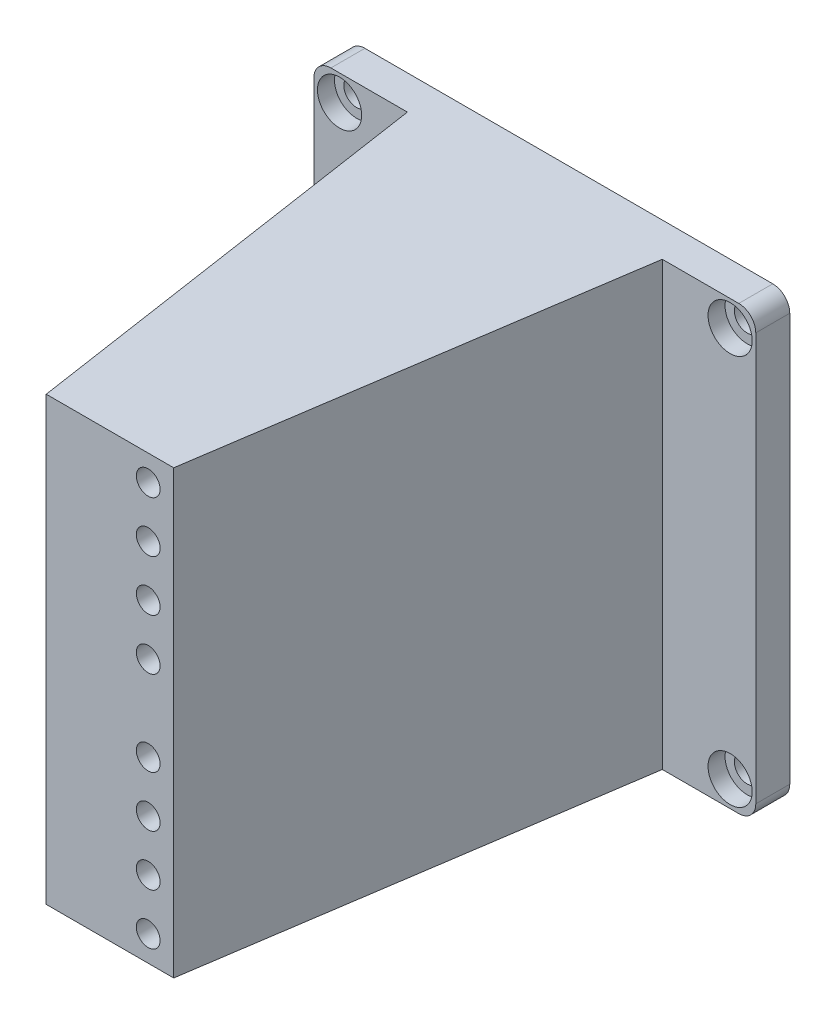
from build123d import *

# Parameters (mm, degrees)
SKETCH1_W           = 52
SKETCH1_H           = 52
BOSS_EXTRUDE1_DEPTH = 4
BOSS_EXTRUDE2_DEPTH = 52
SKETCH5_R           = 1.4
CUT_EXTRUDE4_DEPTH  = 6
SKETCH6_R           = 1.5
CUT_EXTRUDE5_DEPTH  = 6
SKETCH7_R           = 2.6
CUT_EXTRUDE6_DEPTH  = 2
FILLET1_R           = 2


with BuildPart() as part:
    # Sketch1 → Boss-Extrude1 (new body)
    with BuildSketch(Plane.XY):
        with Locations((26, 26)):
            Rectangle(SKETCH1_W, SKETCH1_H)
    extrude(amount=-BOSS_EXTRUDE1_DEPTH)

    # Sketch4 → Boss-Extrude2 (add)
    with BuildSketch(Plane(origin=(0, 52, 0), x_dir=(1, 0, 0), z_dir=(0, 1, 0))):
        Polygon((11, 0), (41, 0), (33.5, -50), (18.5, -50), align=None)
    extrude(amount=-BOSS_EXTRUDE2_DEPTH)

    # Sketch5 → Cut-Extrude4 (cut)
    with BuildSketch(Plane.XY.offset(50)):
        with Locations((30.5, 9)):
            Circle(SKETCH5_R)
        with Locations(Location((30.5, 3, 0), (0, 0, 180))):
            Circle(SKETCH5_R)
        with Locations(Location((30.5, 15, 0), (0, 0, 180))):
            Circle(SKETCH5_R)
        with Locations(Location((30.5, 21, 0), (0, 0, 180))):
            Circle(SKETCH5_R)
        with Locations((30.5, 31)):
            Circle(SKETCH5_R)
        with Locations((30.5, 37)):
            Circle(SKETCH5_R)
        with Locations((30.5, 43)):
            Circle(SKETCH5_R)
        with Locations((30.5, 49)):
            Circle(SKETCH5_R)
    extrude(amount=-CUT_EXTRUDE4_DEPTH, mode=Mode.SUBTRACT)

    # Sketch6 → Cut-Extrude5 (cut)
    with BuildSketch(Plane.XY):
        with Locations((48.980970389, 48.980970389)):
            Circle(SKETCH6_R)
        with Locations((48.980970389, 3.019029611)):
            Circle(SKETCH6_R)
        with Locations((3.019029611, 3.019029611)):
            Circle(SKETCH6_R)
        with Locations((3.019029611, 48.980970389)):
            Circle(SKETCH6_R)
    extrude(amount=-CUT_EXTRUDE5_DEPTH, mode=Mode.SUBTRACT)

    # Sketch7 → Cut-Extrude6 (cut)
    with BuildSketch(Plane.XY):
        with Locations((48.980970389, 48.980970389)):
            Circle(SKETCH7_R)
        with Locations((3.019029611, 48.980970389)):
            Circle(SKETCH7_R)
        with Locations((3.019029611, 3.019029611)):
            Circle(SKETCH7_R)
        with Locations((48.980970389, 3.019029611)):
            Circle(SKETCH7_R)
    extrude(amount=-CUT_EXTRUDE6_DEPTH, mode=Mode.SUBTRACT)

    # Fillet1
    fillet1_edges = [part.edges().sort_by_distance(p)[0] for p in [
        (0, 0, -2),
        (0, 52, -2),
        (52, 52, -2),
        (52, 0, -2),
    ]]
    fillet(fillet1_edges, radius=FILLET1_R)


solid = part.part
